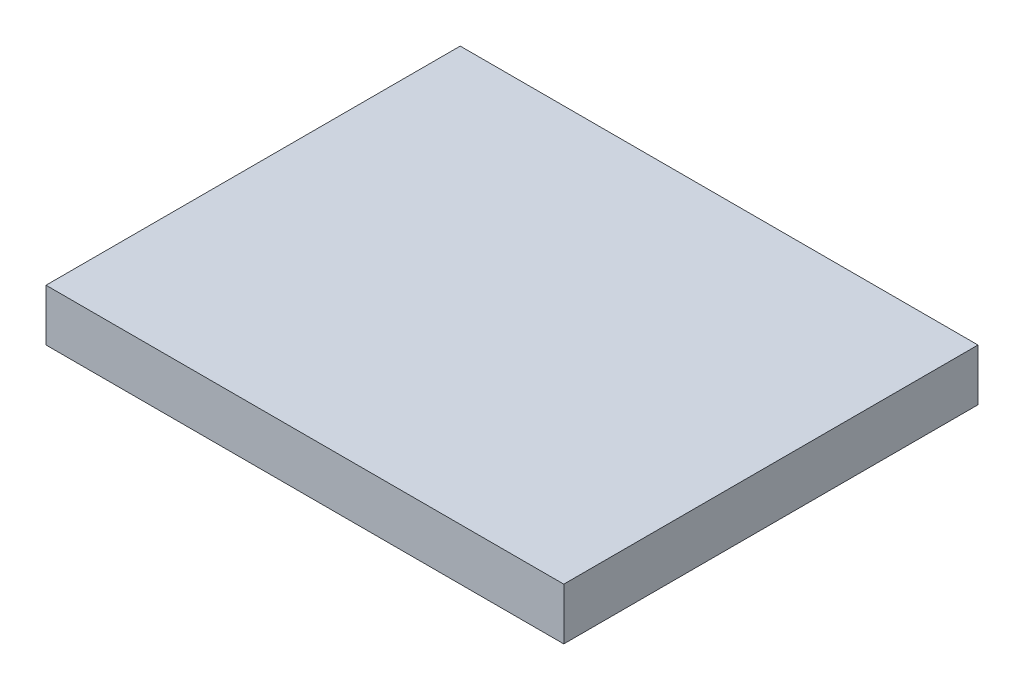
from build123d import *

# Parameters (mm, degrees)
SKETCH1_W           = 50
SKETCH1_H           = 40
BOSS_EXTRUDE1_DEPTH = 5


with BuildPart() as part:
    # Sketch1 → Boss-Extrude1 (new body)
    with BuildSketch(Plane(origin=(0, 0, 0), x_dir=(1, 0, 0), z_dir=(0, 1, 0))):
        with Locations((-25, 20)):
            Rectangle(SKETCH1_W, SKETCH1_H)
    extrude(amount=BOSS_EXTRUDE1_DEPTH)


solid = part.part
